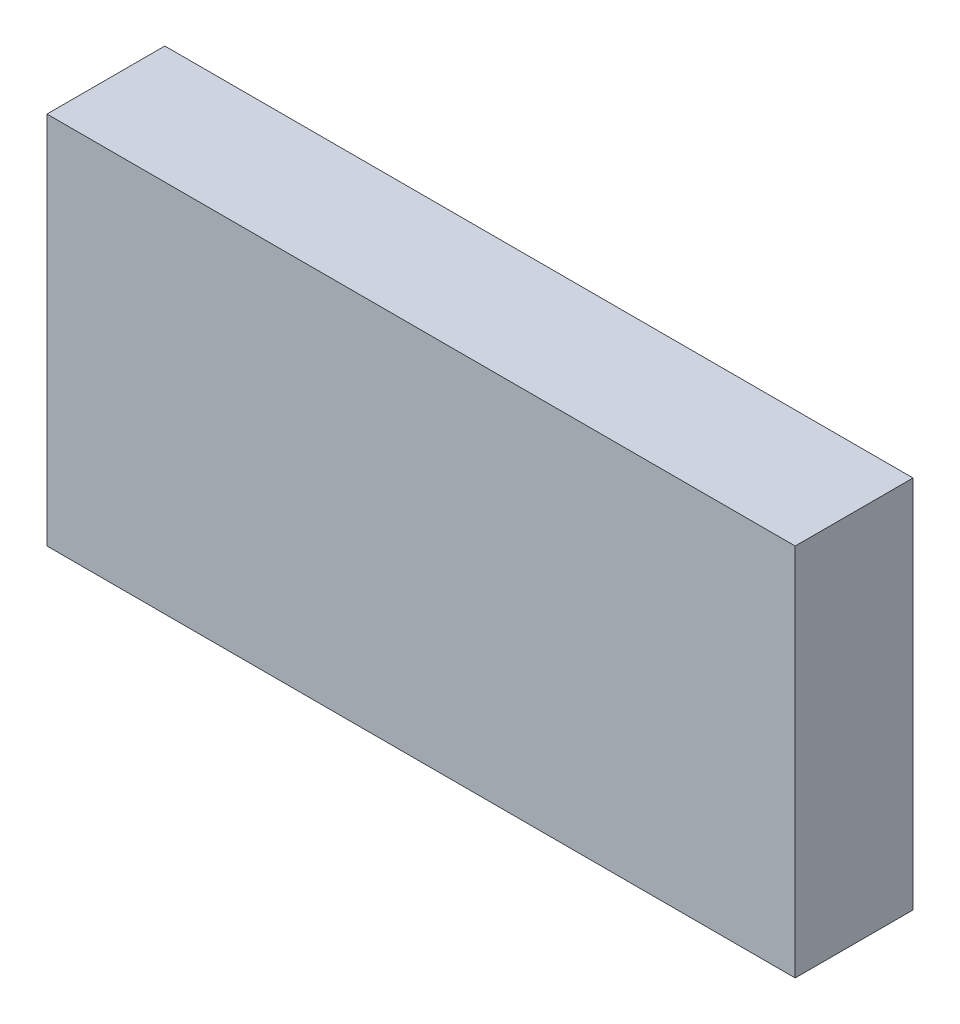
from build123d import *

# Parameters (mm, degrees)
SKETCH1_W           = 40
SKETCH1_H           = 20
BOSS_EXTRUDE1_DEPTH = 6.3


with BuildPart() as part:
    # Sketch1 → Boss-Extrude1 (new body)
    with BuildSketch(Plane.XY):
        with Locations((20, 10)):
            Rectangle(SKETCH1_W, SKETCH1_H)
    extrude(amount=-BOSS_EXTRUDE1_DEPTH)


solid = part.part
